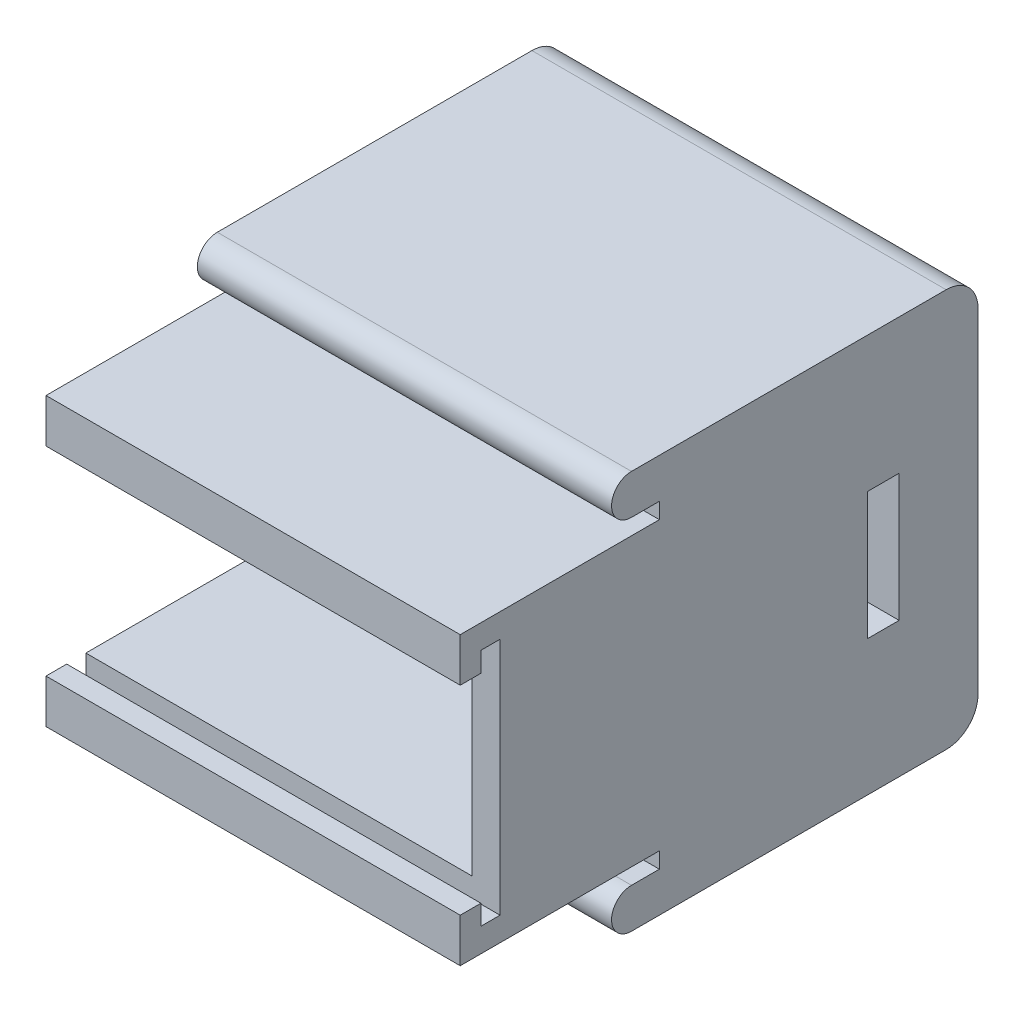
from build123d import *

# Parameters (mm, degrees)
SKETCH_1_W          = 26
SKETCH_1_H          = 25
EXTRUDE_1_DEPTH     = 20
EXTRUDE_3_DEPTH     = 26
SKETCH_4_W          = 26
SKETCH_4_H          = 18
EXTRUDE_4_DEPTH     = 10
SKETCH_5_W          = 22.5
SKETCH_5_H          = 12.5
CUT_EXTRUDE_1_DEPTH = 23.05
CUT_EXTRUDE_5_DEPTH = 3.55
SKETCH_9_W          = 7
SKETCH_9_H          = 8
CUT_EXTRUDE_6_DEPTH = 2
SKETCH_10_W         = 2
SKETCH_10_H         = 8
CUT_EXTRUDE_7_DEPTH = 2
EXTRUDE_5_DEPTH     = 26
FILLET_1_R          = 2


with BuildPart() as part:
    # Эскиз1 → Бобышка-Вытянуть1 (new body)
    with BuildSketch(Plane.XY):
        Rectangle(SKETCH_1_W, SKETCH_1_H)
    extrude(amount=EXTRUDE_1_DEPTH)

    # Эскиз3 → Бобышка-Вытянуть3 (add, through all)
    with BuildSketch(Plane(origin=(13, 0, 0), x_dir=(0, 0, -1), z_dir=(1, 0, 0))):
        with BuildLine():
            Line((-20, 12.5), (-21.75, 12.5))
            ThreePointArc((-21.75, 12.5), (-23, 11.25), (-21.75, 10))
            Line((-21.75, 10), (-20, 10))
            Line((-20, 10), (-20, 12.5))
        make_face()
    extrude_3 = extrude(amount=-EXTRUDE_3_DEPTH)

    # Зеркальное отражение1: Бобышка-Вытянуть3 across plane
    add(extrude_3.mirror(Plane.ZX))

    # Эскиз4 → Бобышка-Вытянуть4 (add)
    with BuildSketch(Plane.XY.offset(20)):
        Rectangle(SKETCH_4_W, SKETCH_4_H)
    extrude(amount=EXTRUDE_4_DEPTH)

    # Эскиз5 → Вырез-Вытянуть1 (cut)
    with BuildSketch(Plane.XY.offset(30)):
        Rectangle(SKETCH_5_W, SKETCH_5_H)
    extrude(amount=-CUT_EXTRUDE_1_DEPTH, mode=Mode.SUBTRACT)

    # Эскиз8 → Вырез-Вытянуть5 (cut)
    with BuildSketch(Plane.ZY.offset(13)):
        with BuildLine():
            Line((30, -6.25), (13.2, -6.25))
            ThreePointArc((13.2, -6.25), (6.95, 0), (13.2, 6.25))
            Line((13.2, 6.25), (30, 6.25))
            Line((30, 6.25), (30, -6.25))
        make_face()
    extrude(amount=-CUT_EXTRUDE_5_DEPTH, mode=Mode.SUBTRACT)

    # Эскиз9 → Вырез-Вытянуть6 (cut)
    with BuildSketch(Plane.XY.offset(6.95)):
        with Locations((7.7560221, 0)):
            Rectangle(SKETCH_9_W, SKETCH_9_H)
    extrude(amount=-CUT_EXTRUDE_6_DEPTH, mode=Mode.SUBTRACT)

    # Эскиз10 → Вырез-Вытянуть7 (cut)
    with BuildSketch(Plane.ZY.offset(-11.2560221)):
        with Locations((5.95, 0)):
            Rectangle(SKETCH_10_W, SKETCH_10_H)
    extrude(amount=-CUT_EXTRUDE_7_DEPTH, mode=Mode.SUBTRACT)

    # Эскиз12 → Бобышка-Вытянуть5 (add, through all)
    with BuildSketch(Plane(origin=(13, 0, 0), x_dir=(0, 0, -1), z_dir=(1, 0, 0))):
        Polygon((-30, 9), (-32.5, 9), (-32.5, 6.25), (-31.2, 6.25), (-31.2, 7.5), (-30, 7.5), align=None)
    extrude_5 = extrude(amount=-EXTRUDE_5_DEPTH)

    # Зеркальное отражение2: Бобышка-Вытянуть5 across plane
    add(extrude_5.mirror(Plane.ZX))

    # Скругление1
    fillet_1_edges = [part.edges().sort_by_distance(p)[0] for p in [
        (0, 12.5, 0),
        (0, -12.5, 0),
    ]]
    fillet(fillet_1_edges, radius=FILLET_1_R)


solid = part.part
